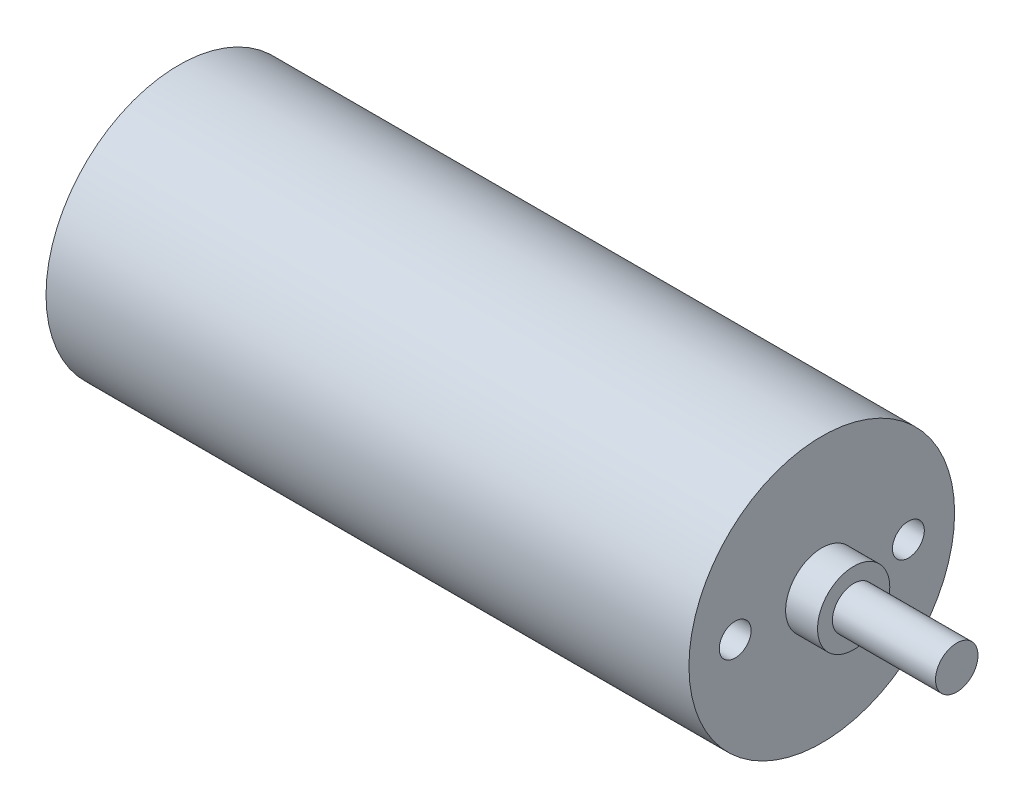
from build123d import *

# Parameters (mm, degrees)
SKETCH3_R          = 1.5
CUT_EXTRUDE1_DEPTH = 3


with BuildPart() as part:
    # Sketch2 → Revolve1 (revolve)
    with BuildSketch(Plane.XY, mode=Mode.PRIVATE) as revolve1_sk:
        Polygon((0, 0), (0, 12.5), (60.5, 12.5), (60.5, 3.400000058), (63.5, 3.400000058), (63.5, 2), (73.2, 2), (73.2, 0), align=None)
    revolve(revolve1_sk.sketch.rotate(Axis((73.2, 0, 0), (-1, 0, 0)), 90), axis=Axis((73.2, 0, 0), (-1, 0, 0)))

    # Sketch3 → Cut-Extrude1 (cut)
    with BuildSketch(Plane(origin=(60.5, 0, 0), x_dir=(0, 0, -1), z_dir=(1, 0, 0))):
        with Locations((8.15, 0)):
            Circle(SKETCH3_R)
        with Locations((-8.15, 0)):
            Circle(SKETCH3_R)
    extrude(amount=-CUT_EXTRUDE1_DEPTH, mode=Mode.SUBTRACT)


solid = part.part
